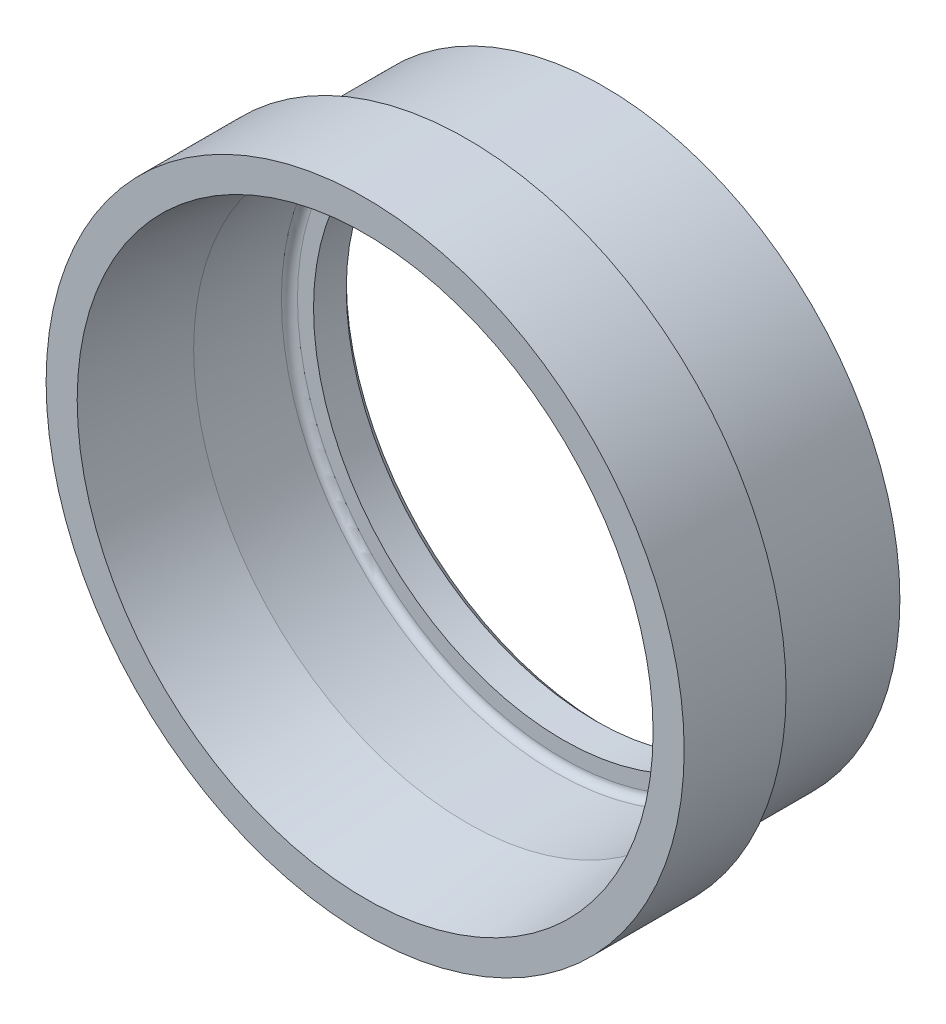
from build123d import *

# Parameters (mm, degrees)
FILLET1_R     = 1
CHAMFER1_SIZE = 1
FILLET2_R     = 1


with BuildPart() as part:
    # Sketch1 → Revolve1 (revolve)
    with BuildSketch(Plane(origin=(0, 0, 0), x_dir=(1, 0, 0), z_dir=(0, 1, 0))):
        Polygon((34.068196428, 24.638), (34.068196428, 12.7), (35.8775, 0), (39.751, 0), (39.751, 12.7), (36.910196428, 12.7), (36.910196428, 29.718), (31.068196428, 29.718), (31.068196428, 24.638), align=None)
    revolve(axis=Axis((0, 0, 0), (0, 0, -1)))

    # Fillet1
    fillet1_edges = [part.edges().sort_by_distance(p)[0] for p in [
        (-36.910196428, 0, -12.7),
    ]]
    fillet(fillet1_edges, radius=FILLET1_R)

    # Chamfer1
    chamfer1_edges = [part.edges().sort_by_distance(p)[0] for p in [
        (-31.068196428, 0, -29.718),
    ]]
    chamfer(chamfer1_edges, length=CHAMFER1_SIZE)

    # Fillet2
    fillet2_edges = [part.edges().sort_by_distance(p)[0] for p in [
        (-34.068196428, 0, -24.638),
    ]]
    fillet(fillet2_edges, radius=FILLET2_R)


solid = part.part
